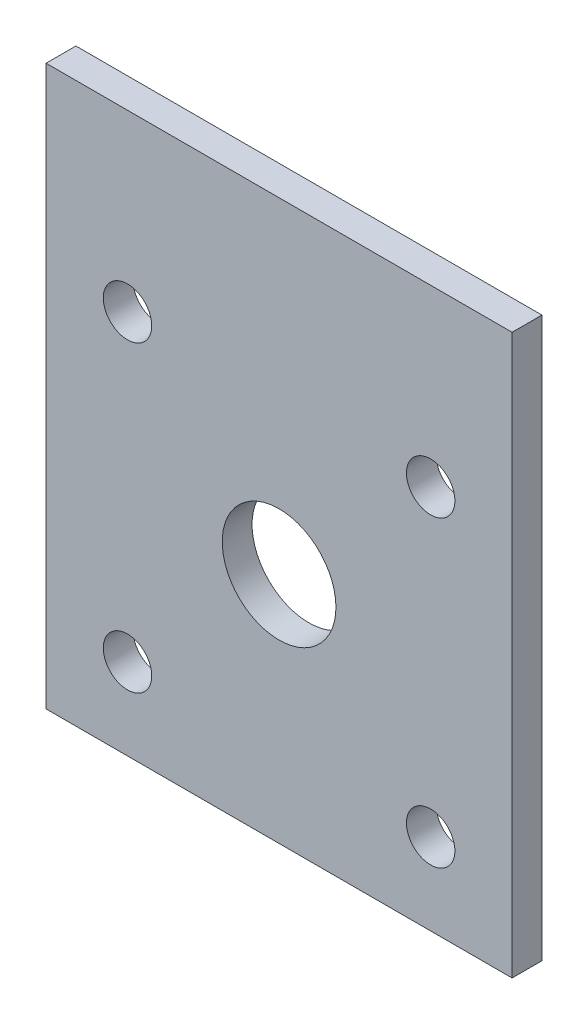
from build123d import *

# Parameters (mm, degrees)
SKETCH_1_W      = 25
SKETCH_1_H      = 30
SKETCH_1_R      = 1.3
SKETCH_1_R_2    = 3.05
EXTRUDE_1_DEPTH = 1.6


with BuildPart() as part:
    # 草图1 → 凸台-拉伸1 (new body)
    with BuildSketch(Plane.XY):
        with Locations((12.5, 15)):
            Rectangle(SKETCH_1_W, SKETCH_1_H)
        with Locations((4.368272016, 20.631727984)):
            Circle(SKETCH_1_R, mode=Mode.SUBTRACT)
        with Locations(Location((20.631727984, 20.631727984, 0), (0, 0, 180))):
            Circle(SKETCH_1_R, mode=Mode.SUBTRACT)
        with Locations((20.631727984, 4.368272016)):
            Circle(SKETCH_1_R, mode=Mode.SUBTRACT)
        with Locations(Location((4.368272016, 4.368272016, 0), (0, 0, 180))):
            Circle(SKETCH_1_R, mode=Mode.SUBTRACT)
        with Locations((12.5, 12.5)):
            Circle(SKETCH_1_R_2, mode=Mode.SUBTRACT)
    extrude(amount=EXTRUDE_1_DEPTH)


solid = part.part
